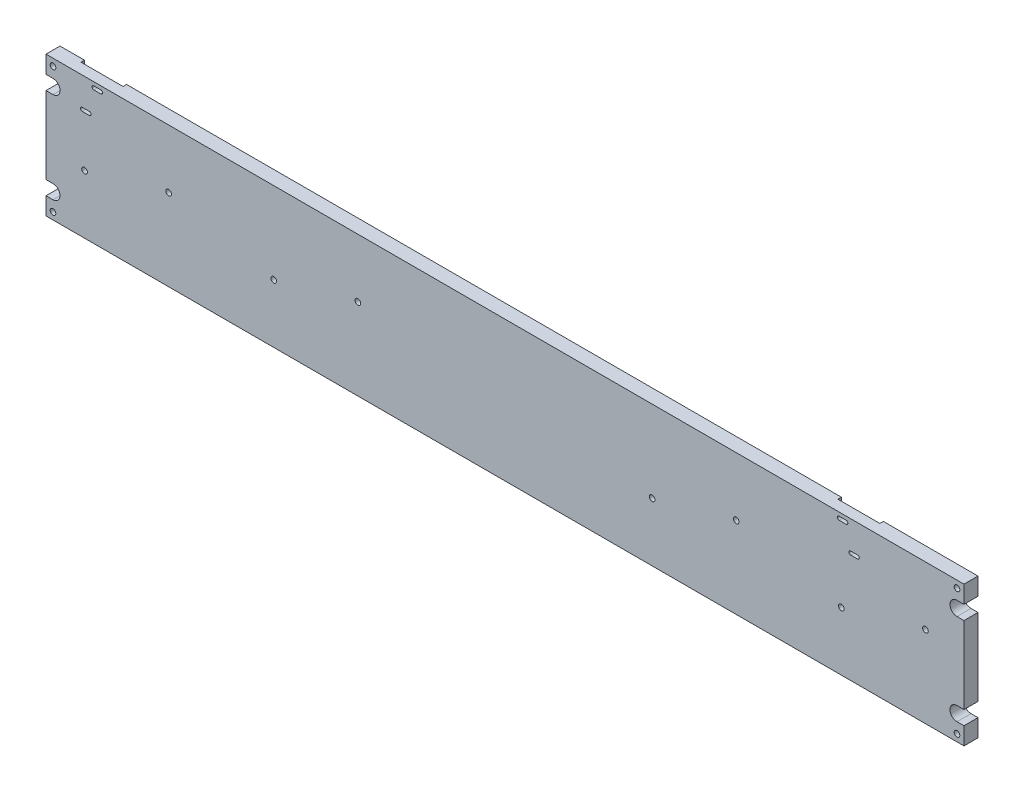
from build123d import *

# Parameters (mm, degrees)
SKETCH1_W                         = 831.85
SKETCH1_H                         = 127
BOSS_EXTRUDE1_DEPTH               = 6.35
F_10_CLEARANCE_HOLE1_D            = 5.1054
TAPPED_HOLE_FOR_10_32_HELICOIL1_D = 5.1054
LPATTERN1_COUNT                   = 5
LPATTERN1_PITCH                   = 171.45
CUT_EXTRUDE1_DEPTH                = 421.936035075
CUT_EXTRUDE3_REACH                = 422.936
CUT_EXTRUDE4_DEPTH                = 3.175


with BuildPart() as part:
    # Sketch1 → Boss-Extrude1 (new, symmetric)
    with BuildSketch(Plane.XY):
        Rectangle(SKETCH1_W, SKETCH1_H)
    extrude(amount=BOSS_EXTRUDE1_DEPTH, both=True)

    # #10 Clearance Hole1 (through all)
    with Locations(Plane(origin=(0, 0, -6.35), x_dir=(-1, 0, 0), z_dir=(0, 0, -1))):
        with Locations((-409.575, 57.15), (-409.575, -57.15)):
            f_10_clearance_hole1 = Hole(F_10_CLEARANCE_HOLE1_D / 2)

    # Tapped Hole for #10-32 Helicoil1 (through all)
    with Locations(Plane(origin=(0, 0, -6.35), x_dir=(-1, 0, 0), z_dir=(0, 0, -1))):
        with Locations((-381, 10.38225), (-304.8, -10.38225)):
            tapped_hole_for_10_32_helicoil1 = Hole(TAPPED_HOLE_FOR_10_32_HELICOIL1_D / 2)

    # LPattern1: Tapped Hole for #10-32 Helicoil1 ×5, 1 skipped
    with Locations(*[(-i * LPATTERN1_PITCH, 0, 0) for i in range(1, LPATTERN1_COUNT) if i not in (2,)]):
        add(tapped_hole_for_10_32_helicoil1, mode=Mode.SUBTRACT)

    # Sketch9 → Cut-Extrude1 (cut, through all)
    with BuildSketch(Plane(origin=(0, 0, -6.35), x_dir=(-1, 0, 0), z_dir=(0, 0, -1))):
        with BuildLine():
            Line((-422.275, 47.625), (-409.575, 47.625))
            ThreePointArc((-409.575, 47.625), (-403.225, 41.275), (-409.575, 34.925))
            Line((-409.575, 34.925), (-422.275, 34.925))
            ThreePointArc((-422.275, 34.925), (-428.625, 41.275), (-422.275, 47.625))
        make_face()
        with BuildLine():
            Line((-422.275, -47.625), (-409.575, -47.625))
            ThreePointArc((-409.575, -47.625), (-403.225, -41.275), (-409.575, -34.925))
            Line((-409.575, -34.925), (-422.275, -34.925))
            ThreePointArc((-422.275, -34.925), (-428.625, -41.275), (-422.275, -47.625))
        make_face()
    cut_extrude1 = extrude(amount=-CUT_EXTRUDE1_DEPTH, mode=Mode.SUBTRACT)

    # Mirror1: #10 Clearance Hole1, Cut-Extrude1 across plane
    add(f_10_clearance_hole1.mirror(Plane(origin=(0, 0, 0), x_dir=(0, 0, 1), z_dir=(1, 0, 0))), mode=Mode.SUBTRACT)
    add(cut_extrude1.mirror(Plane(origin=(0, 0, 0), x_dir=(0, 0, 1), z_dir=(1, 0, 0))), mode=Mode.SUBTRACT)

    # Sketch13 → Cut-Extrude3 (cut, up to next)
    with BuildSketch(Plane.XY.offset(6.35), mode=Mode.PRIVATE) as cut_extrude3_sk1:
        with BuildLine():
            Line((-372.618, 60.2615), (-366.268, 60.2615))
            ThreePointArc((-366.268, 60.2615), (-364.6805, 58.674), (-366.268, 57.0865))
            Line((-366.268, 57.0865), (-372.618, 57.0865))
            ThreePointArc((-372.618, 57.0865), (-374.2055, 58.674), (-372.618, 60.2615))
        make_face()
    cut_extrude3_tool1 = extrude(cut_extrude3_sk1.sketch, amount=-CUT_EXTRUDE3_REACH, mode=Mode.PRIVATE) & part.part
    # Sketch13 → Cut-Extrude3 (cut, up to next)
    with BuildSketch(Plane.XY.offset(6.35), mode=Mode.PRIVATE) as cut_extrude3_sk2:
        with BuildLine():
            Line((-383.032, 38.1635), (-376.682, 38.1635))
            ThreePointArc((-376.682, 38.1635), (-375.0945, 36.576), (-376.682, 34.9885))
            Line((-376.682, 34.9885), (-383.032, 34.9885))
            ThreePointArc((-383.032, 34.9885), (-384.6195, 36.576), (-383.032, 38.1635))
        make_face()
    cut_extrude3_tool2 = extrude(cut_extrude3_sk2.sketch, amount=-CUT_EXTRUDE3_REACH, mode=Mode.PRIVATE) & part.part
    # Sketch13 → Cut-Extrude3 (cut, up to next)
    with BuildSketch(Plane.XY.offset(6.35), mode=Mode.PRIVATE) as cut_extrude3_sk3:
        with BuildLine():
            Line((302.768, 60.2615), (309.118, 60.2615))
            ThreePointArc((309.118, 60.2615), (310.7055, 58.674), (309.118, 57.0865))
            Line((309.118, 57.0865), (302.768, 57.0865))
            ThreePointArc((302.768, 57.0865), (301.1805, 58.674), (302.768, 60.2615))
        make_face()
    cut_extrude3_tool3 = extrude(cut_extrude3_sk3.sketch, amount=-CUT_EXTRUDE3_REACH, mode=Mode.PRIVATE) & part.part
    # Sketch13 → Cut-Extrude3 (cut, up to next)
    with BuildSketch(Plane.XY.offset(6.35), mode=Mode.PRIVATE) as cut_extrude3_sk4:
        with BuildLine():
            Line((313.182, 38.1635), (319.532, 38.1635))
            ThreePointArc((319.532, 38.1635), (321.1195, 36.576), (319.532, 34.9885))
            Line((319.532, 34.9885), (313.182, 34.9885))
            ThreePointArc((313.182, 34.9885), (311.5945, 36.576), (313.182, 38.1635))
        make_face()
    cut_extrude3_tool4 = extrude(cut_extrude3_sk4.sketch, amount=-CUT_EXTRUDE3_REACH, mode=Mode.PRIVATE) & part.part
    add(cut_extrude3_tool1.solids().sort_by_distance((-369.443, 58.674, 6.35))[0], mode=Mode.SUBTRACT)
    add(cut_extrude3_tool2.solids().sort_by_distance((-379.857, 36.576, 6.35))[0], mode=Mode.SUBTRACT)
    add(cut_extrude3_tool3.solids().sort_by_distance((305.943, 58.674, 6.35))[0], mode=Mode.SUBTRACT)
    add(cut_extrude3_tool4.solids().sort_by_distance((316.357, 36.576, 6.35))[0], mode=Mode.SUBTRACT)

    # Sketch14 → Cut-Extrude4 (cut)
    with BuildSketch(Plane(origin=(0, 0, -6.35), x_dir=(-1, 0, 0), z_dir=(0, 0, -1))):
        with BuildLine():
            Line((-330.2, 63.5), (-292.1, 63.5))
            Line((-292.1, 63.5), (-292.1, 31.75))
            ThreePointArc((-292.1, 31.75), (-293.959871939, 27.259871939), (-298.45, 25.4))
            Line((-298.45, 25.4), (-323.85, 25.4))
            ThreePointArc((-323.85, 25.4), (-328.340128061, 27.259871939), (-330.2, 31.75))
            Line((-330.2, 31.75), (-330.2, 63.5))
        make_face()
        with BuildLine():
            Line((355.6, 63.5), (393.7, 63.5))
            Line((393.7, 63.5), (393.7, 31.75))
            ThreePointArc((393.7, 31.75), (391.840128061, 27.259871939), (387.35, 25.4))
            Line((387.35, 25.4), (361.95, 25.4))
            ThreePointArc((361.95, 25.4), (357.459871939, 27.259871939), (355.6, 31.75))
            Line((355.6, 31.75), (355.6, 63.5))
        make_face()
    extrude(amount=-CUT_EXTRUDE4_DEPTH, mode=Mode.SUBTRACT)


solid = part.part
